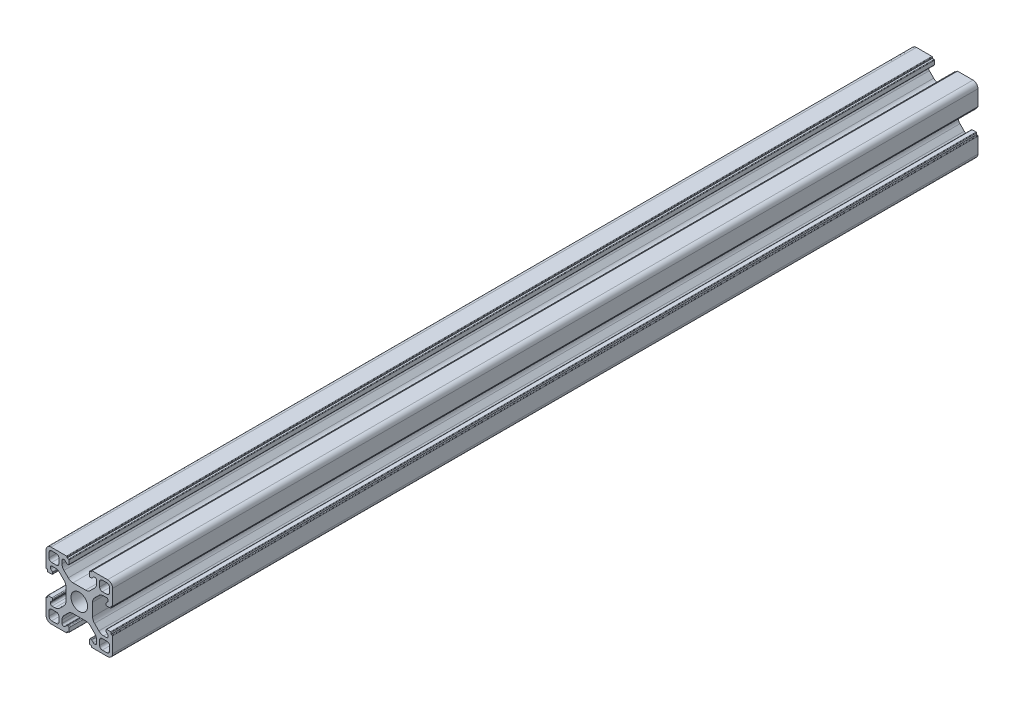
from build123d import *

# Parameters (mm, degrees)
EXTRUDE_1_DEPTH = 260


with BuildPart() as part:
    # Эскиз1 → Бобышка-Вытянуть1 (new body)
    with BuildSketch(Plane.XY):
        with BuildLine():
            Line((-31.105150957, 65.209647948), (-29.206370287, 65.209647948))
            ThreePointArc((-29.206370287, 65.209647948), (-28.441003423, 65.361888883), (-27.792156725, 65.795434385))
            Line((-27.792156725, 65.795434385), (-26.490937394, 67.096653716))
            ThreePointArc((-26.490937394, 67.096653716), (-26.057391892, 67.745500414), (-25.905150957, 68.510867279))
            Line((-25.905150957, 68.510867279), (-25.905150957, 69.409647948))
            ThreePointArc((-25.905150957, 69.409647948), (-26.051597566, 69.763201338), (-26.405150957, 69.909647948))
            Line((-26.405150957, 69.909647948), (-26.508044175, 69.909647948))
            ThreePointArc((-26.508044175, 69.909647948), (-26.699385892, 69.871587714), (-26.861597566, 69.763201338))
            Line((-26.861597566, 69.763201338), (-27.341927652, 69.282871252))
            ThreePointArc((-27.341927652, 69.282871252), (-27.423033489, 69.228678065), (-27.518704347, 69.209647948))
            Line((-27.518704347, 69.209647948), (-27.805150957, 69.209647948))
            ThreePointArc((-27.805150957, 69.209647948), (-27.981927652, 69.282871252), (-28.055150957, 69.459647948))
            Line((-28.055150957, 69.459647948), (-28.055150957, 70.608718768))
            ThreePointArc((-28.055150957, 70.608718768), (-28.011216974, 70.714784785), (-27.905150957, 70.758718768))
            Line((-27.905150957, 70.758718768), (-27.405150957, 70.758718768))
            Line((-27.405150957, 70.758718768), (-27.405150957, 71.059647948))
            ThreePointArc((-27.405150957, 71.059647948), (-27.361216974, 71.165713965), (-27.255150957, 71.209647948))
            Line((-27.255150957, 71.209647948), (-22.605150957, 71.209647948))
            ThreePointArc((-22.605150957, 71.209647948), (-21.544490785, 70.770308119), (-21.105150957, 69.709647948))
            Line((-21.105150957, 69.709647948), (-21.105150957, 65.059647948))
            ThreePointArc((-21.105150957, 65.059647948), (-21.149084939, 64.953581931), (-21.255150957, 64.909647948))
            Line((-21.255150957, 64.909647948), (-21.556080136, 64.909647948))
            Line((-21.556080136, 64.909647948), (-21.556080136, 64.409647948))
            ThreePointArc((-21.556080136, 64.409647948), (-21.600014119, 64.303581931), (-21.706080136, 64.259647948))
            Line((-21.706080136, 64.259647948), (-22.855150957, 64.259647948))
            ThreePointArc((-22.855150957, 64.259647948), (-23.031927652, 64.332871252), (-23.105150957, 64.509647948))
            Line((-23.105150957, 64.509647948), (-23.105150957, 64.796094557))
            ThreePointArc((-23.105150957, 64.796094557), (-23.08612084, 64.891765415), (-23.031927652, 64.972871252))
            Line((-23.031927652, 64.972871252), (-22.551597566, 65.453201338))
            ThreePointArc((-22.551597566, 65.453201338), (-22.44321119, 65.615413013), (-22.405150957, 65.806754729))
            Line((-22.405150957, 65.806754729), (-22.405150957, 65.909647948))
            ThreePointArc((-22.405150957, 65.909647948), (-22.551597566, 66.263201338), (-22.905150957, 66.409647948))
            Line((-22.905150957, 66.409647948), (-23.803931626, 66.409647948))
            ThreePointArc((-23.803931626, 66.409647948), (-24.56929849, 66.257407013), (-25.218145188, 65.82386151))
            Line((-25.218145188, 65.82386151), (-26.519364519, 64.522642179))
            ThreePointArc((-26.519364519, 64.522642179), (-26.952910022, 63.873795482), (-27.105150957, 63.108428617))
            Line((-27.105150957, 63.108428617), (-27.105150957, 61.209647948))
            Line((-27.105150957, 61.209647948), (-27.105150957, 59.310867279))
            ThreePointArc((-27.105150957, 59.310867279), (-26.952910022, 58.545500414), (-26.519364519, 57.896653716))
            Line((-26.519364519, 57.896653716), (-25.218145188, 56.595434385))
            ThreePointArc((-25.218145188, 56.595434385), (-24.56929849, 56.161888883), (-23.803931626, 56.009647948))
            Line((-23.803931626, 56.009647948), (-22.905150957, 56.009647948))
            ThreePointArc((-22.905150957, 56.009647948), (-22.551597566, 56.156094557), (-22.405150957, 56.509647948))
            Line((-22.405150957, 56.509647948), (-22.405150957, 56.612541166))
            ThreePointArc((-22.405150957, 56.612541166), (-22.44321119, 56.803882883), (-22.551597566, 56.966094557))
            Line((-22.551597566, 56.966094557), (-23.031927652, 57.446424643))
            ThreePointArc((-23.031927652, 57.446424643), (-23.08612084, 57.52753048), (-23.105150957, 57.623201338))
            Line((-23.105150957, 57.623201338), (-23.105150957, 57.909647948))
            ThreePointArc((-23.105150957, 57.909647948), (-23.031927652, 58.086424643), (-22.855150957, 58.159647948))
            Line((-22.855150957, 58.159647948), (-21.706080136, 58.159647948))
            ThreePointArc((-21.706080136, 58.159647948), (-21.600014119, 58.115713965), (-21.556080136, 58.009647948))
            Line((-21.556080136, 58.009647948), (-21.556080136, 57.509647948))
            Line((-21.556080136, 57.509647948), (-21.255150957, 57.509647948))
            ThreePointArc((-21.255150957, 57.509647948), (-21.149084939, 57.465713965), (-21.105150957, 57.359647948))
            Line((-21.105150957, 57.359647948), (-21.105150957, 52.709647948))
            ThreePointArc((-21.105150957, 52.709647948), (-21.544490785, 51.648987776), (-22.605150957, 51.209647948))
            Line((-22.605150957, 51.209647948), (-27.255150957, 51.209647948))
            ThreePointArc((-27.255150957, 51.209647948), (-27.361216974, 51.253581931), (-27.405150957, 51.359647948))
            Line((-27.405150957, 51.359647948), (-27.405150957, 51.660577127))
            Line((-27.405150957, 51.660577127), (-27.905150957, 51.660577127))
            ThreePointArc((-27.905150957, 51.660577127), (-28.011216974, 51.70451111), (-28.055150957, 51.810577127))
            Line((-28.055150957, 51.810577127), (-28.055150957, 52.959647948))
            ThreePointArc((-28.055150957, 52.959647948), (-27.981927652, 53.136424643), (-27.805150957, 53.209647948))
            Line((-27.805150957, 53.209647948), (-27.518704347, 53.209647948))
            ThreePointArc((-27.518704347, 53.209647948), (-27.423033489, 53.190617831), (-27.341927652, 53.136424643))
            Line((-27.341927652, 53.136424643), (-26.861597566, 52.656094557))
            ThreePointArc((-26.861597566, 52.656094557), (-26.699385892, 52.547708181), (-26.508044175, 52.509647948))
            Line((-26.508044175, 52.509647948), (-26.405150957, 52.509647948))
            ThreePointArc((-26.405150957, 52.509647948), (-26.051597566, 52.656094557), (-25.905150957, 53.009647948))
            Line((-25.905150957, 53.009647948), (-25.905150957, 53.908428617))
            ThreePointArc((-25.905150957, 53.908428617), (-26.057391892, 54.673795482), (-26.490937394, 55.322642179))
            Line((-26.490937394, 55.322642179), (-27.792156725, 56.62386151))
            ThreePointArc((-27.792156725, 56.62386151), (-28.441003423, 57.057407013), (-29.206370287, 57.209647948))
            Line((-29.206370287, 57.209647948), (-31.105150957, 57.209647948))
            Line((-31.105150957, 57.209647948), (-33.003931626, 57.209647948))
            ThreePointArc((-33.003931626, 57.209647948), (-33.76929849, 57.057407013), (-34.418145188, 56.62386151))
            Line((-34.418145188, 56.62386151), (-35.719364519, 55.322642179))
            ThreePointArc((-35.719364519, 55.322642179), (-36.152910022, 54.673795482), (-36.305150957, 53.908428617))
            Line((-36.305150957, 53.908428617), (-36.305150957, 53.009647948))
            ThreePointArc((-36.305150957, 53.009647948), (-36.158704347, 52.656094557), (-35.805150957, 52.509647948))
            Line((-35.805150957, 52.509647948), (-35.702257738, 52.509647948))
            ThreePointArc((-35.702257738, 52.509647948), (-35.510916022, 52.547708181), (-35.348704347, 52.656094557))
            Line((-35.348704347, 52.656094557), (-34.868374261, 53.136424643))
            ThreePointArc((-34.868374261, 53.136424643), (-34.787268424, 53.190617831), (-34.691597566, 53.209647948))
            Line((-34.691597566, 53.209647948), (-34.405150957, 53.209647948))
            ThreePointArc((-34.405150957, 53.209647948), (-34.228374261, 53.136424643), (-34.155150957, 52.959647948))
            Line((-34.155150957, 52.959647948), (-34.155150957, 51.810577127))
            ThreePointArc((-34.155150957, 51.810577127), (-34.199084939, 51.70451111), (-34.305150957, 51.660577127))
            Line((-34.305150957, 51.660577127), (-34.805150957, 51.660577127))
            Line((-34.805150957, 51.660577127), (-34.805150957, 51.359647948))
            ThreePointArc((-34.805150957, 51.359647948), (-34.849084939, 51.253581931), (-34.955150957, 51.209647948))
            Line((-34.955150957, 51.209647948), (-39.605150957, 51.209647948))
            ThreePointArc((-39.605150957, 51.209647948), (-40.665811128, 51.648987776), (-41.105150957, 52.709647948))
            Line((-41.105150957, 52.709647948), (-41.105150957, 57.359647948))
            ThreePointArc((-41.105150957, 57.359647948), (-41.061216974, 57.465713965), (-40.955150957, 57.509647948))
            Line((-40.955150957, 57.509647948), (-40.654221777, 57.509647948))
            Line((-40.654221777, 57.509647948), (-40.654221777, 58.009647948))
            ThreePointArc((-40.654221777, 58.009647948), (-40.610287794, 58.115713965), (-40.504221777, 58.159647948))
            Line((-40.504221777, 58.159647948), (-39.355150957, 58.159647948))
            ThreePointArc((-39.355150957, 58.159647948), (-39.178374261, 58.086424643), (-39.105150957, 57.909647948))
            Line((-39.105150957, 57.909647948), (-39.105150957, 57.623201338))
            ThreePointArc((-39.105150957, 57.623201338), (-39.124181073, 57.52753048), (-39.178374261, 57.446424643))
            Line((-39.178374261, 57.446424643), (-39.658704347, 56.966094557))
            ThreePointArc((-39.658704347, 56.966094557), (-39.767090723, 56.803882883), (-39.805150957, 56.612541166))
            Line((-39.805150957, 56.612541166), (-39.805150957, 56.509647948))
            ThreePointArc((-39.805150957, 56.509647948), (-39.658704347, 56.156094557), (-39.305150957, 56.009647948))
            Line((-39.305150957, 56.009647948), (-38.406370287, 56.009647948))
            ThreePointArc((-38.406370287, 56.009647948), (-37.641003423, 56.161888883), (-36.992156725, 56.595434385))
            Line((-36.992156725, 56.595434385), (-35.690937394, 57.896653716))
            ThreePointArc((-35.690937394, 57.896653716), (-35.257391892, 58.545500414), (-35.105150957, 59.310867279))
            Line((-35.105150957, 59.310867279), (-35.105150957, 61.209647948))
            Line((-35.105150957, 61.209647948), (-35.105150957, 63.108428617))
            ThreePointArc((-35.105150957, 63.108428617), (-35.257391892, 63.873795482), (-35.690937394, 64.522642179))
            Line((-35.690937394, 64.522642179), (-36.992156725, 65.82386151))
            ThreePointArc((-36.992156725, 65.82386151), (-37.641003423, 66.257407013), (-38.406370287, 66.409647948))
            Line((-38.406370287, 66.409647948), (-39.305150957, 66.409647948))
            ThreePointArc((-39.305150957, 66.409647948), (-39.658704347, 66.263201338), (-39.805150957, 65.909647948))
            Line((-39.805150957, 65.909647948), (-39.805150957, 65.806754729))
            ThreePointArc((-39.805150957, 65.806754729), (-39.767090723, 65.615413013), (-39.658704347, 65.453201338))
            Line((-39.658704347, 65.453201338), (-39.178374261, 64.972871252))
            ThreePointArc((-39.178374261, 64.972871252), (-39.124181073, 64.891765415), (-39.105150957, 64.796094557))
            Line((-39.105150957, 64.796094557), (-39.105150957, 64.509647948))
            ThreePointArc((-39.105150957, 64.509647948), (-39.178374261, 64.332871252), (-39.355150957, 64.259647948))
            Line((-39.355150957, 64.259647948), (-40.504221777, 64.259647948))
            ThreePointArc((-40.504221777, 64.259647948), (-40.610287794, 64.303581931), (-40.654221777, 64.409647948))
            Line((-40.654221777, 64.409647948), (-40.654221777, 64.909647948))
            Line((-40.654221777, 64.909647948), (-40.955150957, 64.909647948))
            ThreePointArc((-40.955150957, 64.909647948), (-41.061216974, 64.953581931), (-41.105150957, 65.059647948))
            Line((-41.105150957, 65.059647948), (-41.105150957, 69.709647948))
            ThreePointArc((-41.105150957, 69.709647948), (-40.665811128, 70.770308119), (-39.605150957, 71.209647948))
            Line((-39.605150957, 71.209647948), (-34.955150957, 71.209647948))
            ThreePointArc((-34.955150957, 71.209647948), (-34.849084939, 71.165713965), (-34.805150957, 71.059647948))
            Line((-34.805150957, 71.059647948), (-34.805150957, 70.758718768))
            Line((-34.805150957, 70.758718768), (-34.305150957, 70.758718768))
            ThreePointArc((-34.305150957, 70.758718768), (-34.199084939, 70.714784785), (-34.155150957, 70.608718768))
            Line((-34.155150957, 70.608718768), (-34.155150957, 69.459647948))
            ThreePointArc((-34.155150957, 69.459647948), (-34.228374261, 69.282871252), (-34.405150957, 69.209647948))
            Line((-34.405150957, 69.209647948), (-34.691597566, 69.209647948))
            ThreePointArc((-34.691597566, 69.209647948), (-34.787268424, 69.228678065), (-34.868374261, 69.282871252))
            Line((-34.868374261, 69.282871252), (-35.348704347, 69.763201338))
            ThreePointArc((-35.348704347, 69.763201338), (-35.510916022, 69.871587714), (-35.702257738, 69.909647948))
            Line((-35.702257738, 69.909647948), (-35.805150957, 69.909647948))
            ThreePointArc((-35.805150957, 69.909647948), (-36.158704347, 69.763201338), (-36.305150957, 69.409647948))
            Line((-36.305150957, 69.409647948), (-36.305150957, 68.510867279))
            ThreePointArc((-36.305150957, 68.510867279), (-36.152910022, 67.745500414), (-35.719364519, 67.096653716))
            Line((-35.719364519, 67.096653716), (-34.418145188, 65.795434385))
            ThreePointArc((-34.418145188, 65.795434385), (-33.76929849, 65.361888883), (-33.003931626, 65.209647948))
            Line((-33.003931626, 65.209647948), (-31.105150957, 65.209647948))
        make_face()
        with BuildLine():
            Line((-24.205150957, 67.309647948), (-22.805150957, 67.309647948))
            ThreePointArc((-22.805150957, 67.309647948), (-22.239465532, 67.543962523), (-22.005150957, 68.109647948))
            Line((-22.005150957, 68.109647948), (-22.005150957, 69.509647948))
            ThreePointArc((-22.005150957, 69.509647948), (-22.239465532, 70.075333373), (-22.805150957, 70.309647948))
            Line((-22.805150957, 70.309647948), (-24.205150957, 70.309647948))
            ThreePointArc((-24.205150957, 70.309647948), (-24.770836381, 70.075333373), (-25.005150957, 69.509647948))
            Line((-25.005150957, 69.509647948), (-25.005150957, 68.109647948))
            ThreePointArc((-25.005150957, 68.109647948), (-24.770836381, 67.543962523), (-24.205150957, 67.309647948))
        make_face(mode=Mode.SUBTRACT)
        with BuildLine():
            Line((-25.005150957, 54.309647948), (-25.005150957, 52.909647948))
            ThreePointArc((-25.005150957, 52.909647948), (-24.770836381, 52.343962523), (-24.205150957, 52.109647948))
            Line((-24.205150957, 52.109647948), (-22.805150957, 52.109647948))
            ThreePointArc((-22.805150957, 52.109647948), (-22.239465532, 52.343962523), (-22.005150957, 52.909647948))
            Line((-22.005150957, 52.909647948), (-22.005150957, 54.309647948))
            ThreePointArc((-22.005150957, 54.309647948), (-22.239465532, 54.875333373), (-22.805150957, 55.109647948))
            Line((-22.805150957, 55.109647948), (-24.205150957, 55.109647948))
            ThreePointArc((-24.205150957, 55.109647948), (-24.770836381, 54.875333373), (-25.005150957, 54.309647948))
        make_face(mode=Mode.SUBTRACT)
        with BuildLine():
            Line((-38.005150957, 55.109647948), (-39.405150957, 55.109647948))
            ThreePointArc((-39.405150957, 55.109647948), (-39.970836381, 54.875333373), (-40.205150957, 54.309647948))
            Line((-40.205150957, 54.309647948), (-40.205150957, 52.909647948))
            ThreePointArc((-40.205150957, 52.909647948), (-39.970836381, 52.343962523), (-39.405150957, 52.109647948))
            Line((-39.405150957, 52.109647948), (-38.005150957, 52.109647948))
            ThreePointArc((-38.005150957, 52.109647948), (-37.439465532, 52.343962523), (-37.205150957, 52.909647948))
            Line((-37.205150957, 52.909647948), (-37.205150957, 54.309647948))
            ThreePointArc((-37.205150957, 54.309647948), (-37.439465532, 54.875333373), (-38.005150957, 55.109647948))
        make_face(mode=Mode.SUBTRACT)
        with BuildLine():
            Line((-37.205150957, 68.109647948), (-37.205150957, 69.509647948))
            ThreePointArc((-37.205150957, 69.509647948), (-37.439465532, 70.075333373), (-38.005150957, 70.309647948))
            Line((-38.005150957, 70.309647948), (-39.405150957, 70.309647948))
            ThreePointArc((-39.405150957, 70.309647948), (-39.970836381, 70.075333373), (-40.205150957, 69.509647948))
            Line((-40.205150957, 69.509647948), (-40.205150957, 68.109647948))
            ThreePointArc((-40.205150957, 68.109647948), (-39.970836381, 67.543962523), (-39.405150957, 67.309647948))
            Line((-39.405150957, 67.309647948), (-38.005150957, 67.309647948))
            ThreePointArc((-38.005150957, 67.309647948), (-37.439465532, 67.543962523), (-37.205150957, 68.109647948))
        make_face(mode=Mode.SUBTRACT)
        with BuildLine():
            ThreePointArc((-28.605150957, 61.209647948), (-29.337384004, 62.977414901), (-31.105150957, 63.709647948))
            ThreePointArc((-31.105150957, 63.709647948), (-32.87291791, 62.977414901), (-33.605150957, 61.209647948))
            ThreePointArc((-33.605150957, 61.209647948), (-32.87291791, 59.441880995), (-31.105150957, 58.709647948))
            ThreePointArc((-31.105150957, 58.709647948), (-29.337384004, 59.441880995), (-28.605150957, 61.209647948))
        make_face(mode=Mode.SUBTRACT)
    extrude(amount=EXTRUDE_1_DEPTH)


solid = part.part
